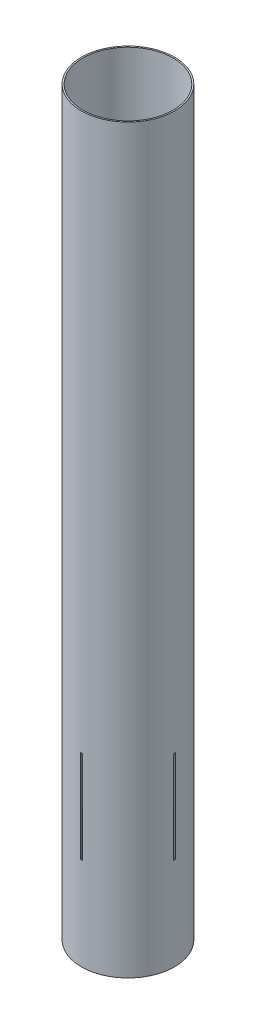
from build123d import *

# Parameters (mm, degrees)
SKETCH1_R           = 51.1048
SKETCH1_R_2         = 49.53
BOSS_EXTRUDE1_DEPTH = 812.8
CUT_EXTRUDE1_DEPTH  = 101.6


with BuildPart() as part:
    # Sketch1 → Boss-Extrude1 (new body)
    with BuildSketch(Plane(origin=(0, 0, 0), x_dir=(1, 0, 0), z_dir=(0, 1, 0))):
        with Locations(Location((0, 0, 0), (0, 0, 270))):
            Circle(SKETCH1_R)
        with Locations(Location((0, 0, 0), (0, 0, 270))):
            Circle(SKETCH1_R_2, mode=Mode.SUBTRACT)
    extrude(amount=BOSS_EXTRUDE1_DEPTH)

    # Sketch2 → Cut-Extrude1 (cut)
    with BuildSketch(Plane(origin=(0, 101.6, 0), x_dir=(-1, 0, 0), z_dir=(0, -1, 0))):
        with BuildLine():
            Line((-1.14808, 51.727157019), (-1.14808, 48.633812989))
            ThreePointArc((-1.14808, 48.633812989), (0, 48.647362247), (1.14808, 48.633812989))
            Line((1.14808, 48.633812989), (1.14808, 51.727157019))
            ThreePointArc((1.14808, 51.727157019), (0, 51.739896221), (-1.14808, 51.727157019))
        make_face()
        with BuildLine():
            Line((51.727157019, 1.14808), (48.633812989, 1.14808))
            ThreePointArc((48.633812989, 1.14808), (48.647362247, 0), (48.633812989, -1.14808))
            Line((48.633812989, -1.14808), (51.727157019, -1.14808))
            ThreePointArc((51.727157019, -1.14808), (51.739896221, 0), (51.727157019, 1.14808))
        make_face()
        with BuildLine():
            Line((1.14808, -51.727157019), (1.14808, -48.633812989))
            ThreePointArc((1.14808, -48.633812989), (0, -48.647362247), (-1.14808, -48.633812989))
            Line((-1.14808, -48.633812989), (-1.14808, -51.727157019))
            ThreePointArc((-1.14808, -51.727157019), (0, -51.739896221), (1.14808, -51.727157019))
        make_face()
        with BuildLine():
            Line((-51.727157019, -1.14808), (-48.633812989, -1.14808))
            ThreePointArc((-48.633812989, -1.14808), (-48.647362247, 0), (-48.633812989, 1.14808))
            Line((-48.633812989, 1.14808), (-51.727157019, 1.14808))
            ThreePointArc((-51.727157019, 1.14808), (-51.739896221, 0), (-51.727157019, -1.14808))
        make_face()
    extrude(amount=-CUT_EXTRUDE1_DEPTH, mode=Mode.SUBTRACT)


solid = part.part
